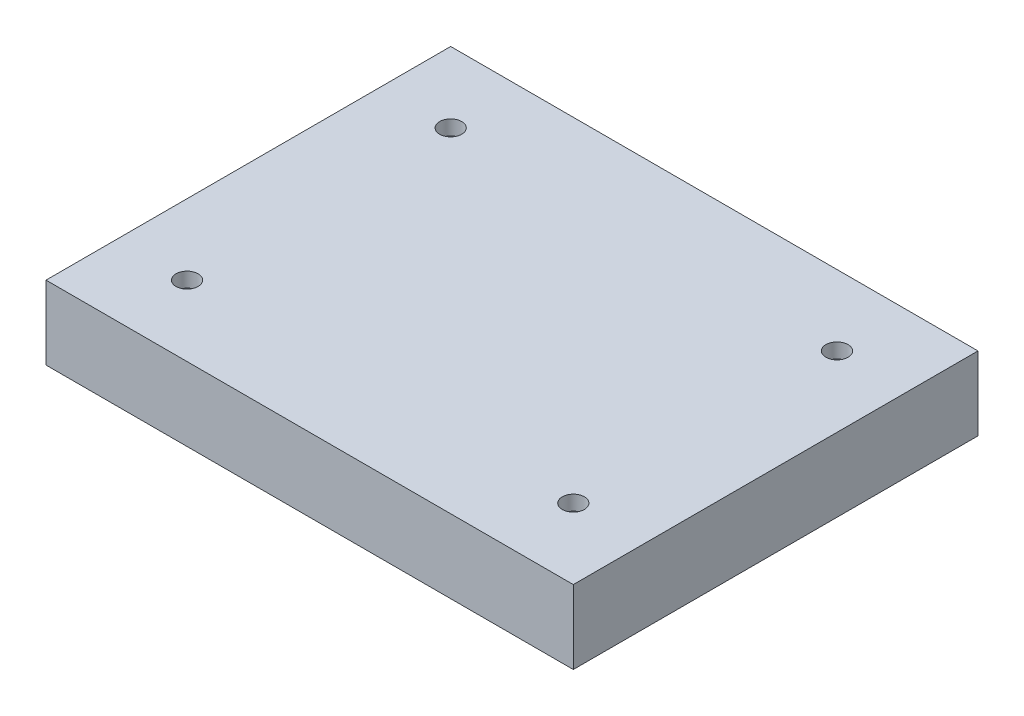
from build123d import *

# Parameters (mm, degrees)
SKETCH1_W           = 86
SKETCH1_H           = 66
BOSS_EXTRUDE1_DEPTH = 12
SKETCH2_W           = 81.2
SKETCH2_H           = 61.2
CUT_EXTRUDE1_DEPTH  = 9.6
SKETCH3_R           = 3
BOSS_EXTRUDE2_DEPTH = 4.5
SKETCH4_R           = 1.8
CUT_EXTRUDE2_DEPTH  = 4.5


with BuildPart() as part:
    # Sketch1 → Boss-Extrude1 (new body)
    with BuildSketch(Plane(origin=(0, 0, 0), x_dir=(1, 0, 0), z_dir=(0, 1, 0))):
        Rectangle(SKETCH1_W, SKETCH1_H)
    extrude(amount=BOSS_EXTRUDE1_DEPTH)

    # Sketch2 → Cut-Extrude1 (cut)
    with BuildSketch(Plane.XZ):
        Rectangle(SKETCH2_W, SKETCH2_H)
    extrude(amount=-CUT_EXTRUDE1_DEPTH, mode=Mode.SUBTRACT)

    # Sketch3 → Boss-Extrude2 (add)
    with BuildSketch(Plane.XZ.offset(-9.6)):
        with Locations(Location((-31.5, -21.5, 0), (0, 0, 90))):
            Circle(SKETCH3_R)
        with Locations(Location((31.5, -21.5, 0), (0, 0, 90))):
            Circle(SKETCH3_R)
        with Locations(Location((-31.5, 21.5, 0), (0, 0, 90))):
            Circle(SKETCH3_R)
        with Locations(Location((31.5, 21.5, 0), (0, 0, 90))):
            Circle(SKETCH3_R)
    extrude(amount=BOSS_EXTRUDE2_DEPTH)

    # Sketch4 → Cut-Extrude2 (cut)
    with BuildSketch(Plane.XZ.offset(-9.6)):
        with Locations(Location((-31.5, -21.5, 0), (0, 0, 270))):
            Circle(SKETCH4_R)
        with Locations(Location((31.5, -21.5, 0), (0, 0, 270))):
            Circle(SKETCH4_R)
        with Locations(Location((-31.5, 21.5, 0), (0, 0, 270))):
            Circle(SKETCH4_R)
        with Locations(Location((31.5, 21.5, 0), (0, 0, 270))):
            Circle(SKETCH4_R)
    extrude(amount=-CUT_EXTRUDE2_DEPTH, mode=Mode.SUBTRACT)


solid = part.part
